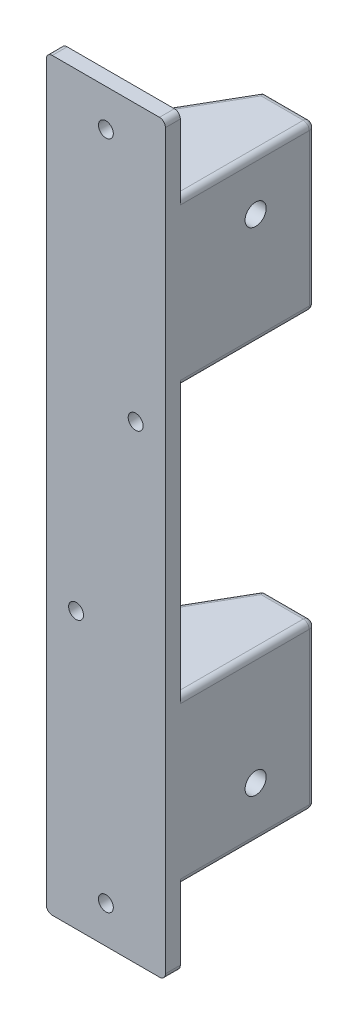
from build123d import *

# Parameters (mm, degrees)
BOSS_EXTRUDE1_DEPTH     = 127
CUT_EXTRUDE1_START      = -31.75
CUT_EXTRUDE1_DEPTH      = 28.575
CUT_EXTRUDE2_START      = 31.75
CUT_EXTRUDE2_DEPTH      = 28.575
SKETCH3_W               = 25.4
SKETCH3_H               = 50.8
CUT_EXTRUDE4_DEPTH      = 28.575
CUT_EXTRUDE7_DEPTH      = 140.18702407
CUT_EXTRUDE7_DEPTH_BACK = 140.18702407
CUT_EXTRUDE6_DEPTH      = 133.668601113
CUT_EXTRUDE6_DEPTH_BACK = 133.668601113
SKETCH5_R               = 1.5875
CUT_EXTRUDE9_DEPTH      = 133.824762172
CUT_EXTRUDE9_DEPTH_BACK = 133.824762172
SKETCH8_R               = 2.25
SKETCH9_W               = 25.4
SKETCH9_H               = 15.875
SKETCH9_R               = 1.5875
BOSS_EXTRUDE2_DEPTH     = 3.175
FILLET1_R               = 1.27


with BuildPart() as part:
    # Sketch1 → Boss-Extrude1 (new body)
    with BuildSketch(Plane(origin=(0, 0, 0), x_dir=(1, 0, 0), z_dir=(0, 1, 0))):
        Polygon((0, 0), (-25.4, 0), (-25.4, 6.985), (0, 50.979090512), align=None)
    extrude(amount=BOSS_EXTRUDE1_DEPTH)

    # Sketch2 → Cut-Extrude1 (cut)
    with BuildSketch(Plane(origin=(0, 63.5, 0), x_dir=(-1, 0, 0), z_dir=(0, -1, 0)).offset(CUT_EXTRUDE1_START)):
        Polygon((25.4, 6.985), (3.175, 45.479829198), (3.175, 3.175), (25.4, 3.175), align=None)
    extrude(amount=-CUT_EXTRUDE1_DEPTH, mode=Mode.SUBTRACT)

    # Sketch2<2> → Cut-Extrude2 (cut)
    with BuildSketch(Plane(origin=(0, 63.5, 0), x_dir=(-1, 0, 0), z_dir=(0, -1, 0)).offset(CUT_EXTRUDE2_START)):
        Polygon((25.4, 6.985), (3.175, 45.479829198), (3.175, 3.175), (25.4, 3.175), align=None)
    extrude(amount=CUT_EXTRUDE2_DEPTH, mode=Mode.SUBTRACT)

    # Sketch3 → Cut-Extrude4 (cut, symmetric)
    with BuildSketch(Plane(origin=(0, 63.5, 0), x_dir=(-1, 0, 0), z_dir=(0, -1, 0))):
        with Locations((12.7, 28.575)):
            Rectangle(SKETCH3_W, SKETCH3_H)
    extrude(amount=CUT_EXTRUDE4_DEPTH, both=True, mode=Mode.SUBTRACT)

    # Sketch6 → Cut-Extrude7 (cut, two sides: drawn at the far end of the back side and taken through both)
    with BuildSketch(Plane.XZ.offset(-CUT_EXTRUDE7_DEPTH_BACK)):
        Polygon((0, -31.929090512), (0, -50.979090512), (-10.998522628, -31.929090512), align=None)
    extrude(amount=CUT_EXTRUDE7_DEPTH + CUT_EXTRUDE7_DEPTH_BACK, mode=Mode.SUBTRACT)

    # Sketch5 → Cut-Extrude6 (cut, two sides: drawn at the far end of the back side and taken through both)
    with BuildSketch(Plane(origin=(0, 0, -3.175), x_dir=(-1, 0, 0), z_dir=(0, 0, -1)).offset(-CUT_EXTRUDE6_DEPTH_BACK)):
        with Locations((6.35, 84.1375)):
            Circle(SKETCH5_R)
        with Locations((19.05, 42.8625)):
            Circle(SKETCH5_R)
    extrude(amount=CUT_EXTRUDE6_DEPTH + CUT_EXTRUDE6_DEPTH_BACK, mode=Mode.SUBTRACT)

    # Sketch8 → Cut-Extrude9 (cut, two sides: drawn at the far end of the back side and taken through both)
    with BuildSketch(Plane.ZY.offset(3.175).offset(-CUT_EXTRUDE9_DEPTH_BACK)):
        with Locations((-19.229090512, 11)):
            Circle(SKETCH8_R)
        with Locations((-19.229090512, 116)):
            Circle(SKETCH8_R)
    extrude(amount=CUT_EXTRUDE9_DEPTH + CUT_EXTRUDE9_DEPTH_BACK, mode=Mode.SUBTRACT)

    # Sketch9 → Boss-Extrude2 (add)
    # profile 1 of 2: a face of its own
    with BuildSketch(Plane.XY):
        with Locations((-12.7, -7.9375)):
            Rectangle(SKETCH9_W, SKETCH9_H)
        with Locations((-12.7, -7.9375)):
            Circle(SKETCH9_R, mode=Mode.SUBTRACT)
    # profile 2 of 2: a face of its own
    with BuildSketch(Plane.XY):
        with Locations((-12.7, 134.9375)):
            Rectangle(SKETCH9_W, SKETCH9_H)
        with Locations(Location((-12.7, 134.9375, 0), (0, 0, 180))):
            Circle(SKETCH9_R, mode=Mode.SUBTRACT)
    extrude(amount=-BOSS_EXTRUDE2_DEPTH)

    # Fillet1
    fillet1_edges = [part.edges().sort_by_distance(p)[0] for p in [
        (0, 0, -17.552045256),
        (0, -15.875, -1.5875),
        (-25.4, -15.875, -1.5875),
        (-25.4, 127, -5.08),
        (0, 127, -17.552045256),
        (-25.4, 142.875, -1.5875),
        (0, 142.875, -1.5875),
        (-3.175, 109.5375, -3.175),
        (-14.2875, 95.25, -3.175),
        (-14.2875, 123.825, -3.175),
        (-3.175, 123.825, -17.552045256),
        (-3.175, 17.4625, -3.175),
        (-14.2875, 31.75, -3.175),
        (-14.2875, 3.175, -3.175),
        (-25.4, 92.075, -5.08),
        (-25.4, 34.925, -5.08),
        (-18.199261314, 34.925, -19.457045256),
        (-18.199261314, 92.075, -19.457045256),
        (-25.4, 0, -5.08),
        (0, 34.925, -17.552045256),
        (-5.499261314, 34.925, -31.929090512),
        (0, 92.075, -17.552045256),
        (-3.175, 3.175, -17.552045256),
        (-3.175, 31.75, -17.552045256),
        (-3.175, 95.25, -17.552045256),
        (-18.199261314, 0, -19.457045256),
        (-18.199261314, 127, -19.457045256),
        (-5.499261314, 0, -31.929090512),
        (-5.499261314, 127, -31.929090512),
        (-5.499261314, 92.075, -31.929090512),
        (0, 17.4625, -31.929090512),
        (0, 109.5375, -31.929090512),
    ]]
    fillet(fillet1_edges, radius=FILLET1_R)


solid = part.part
